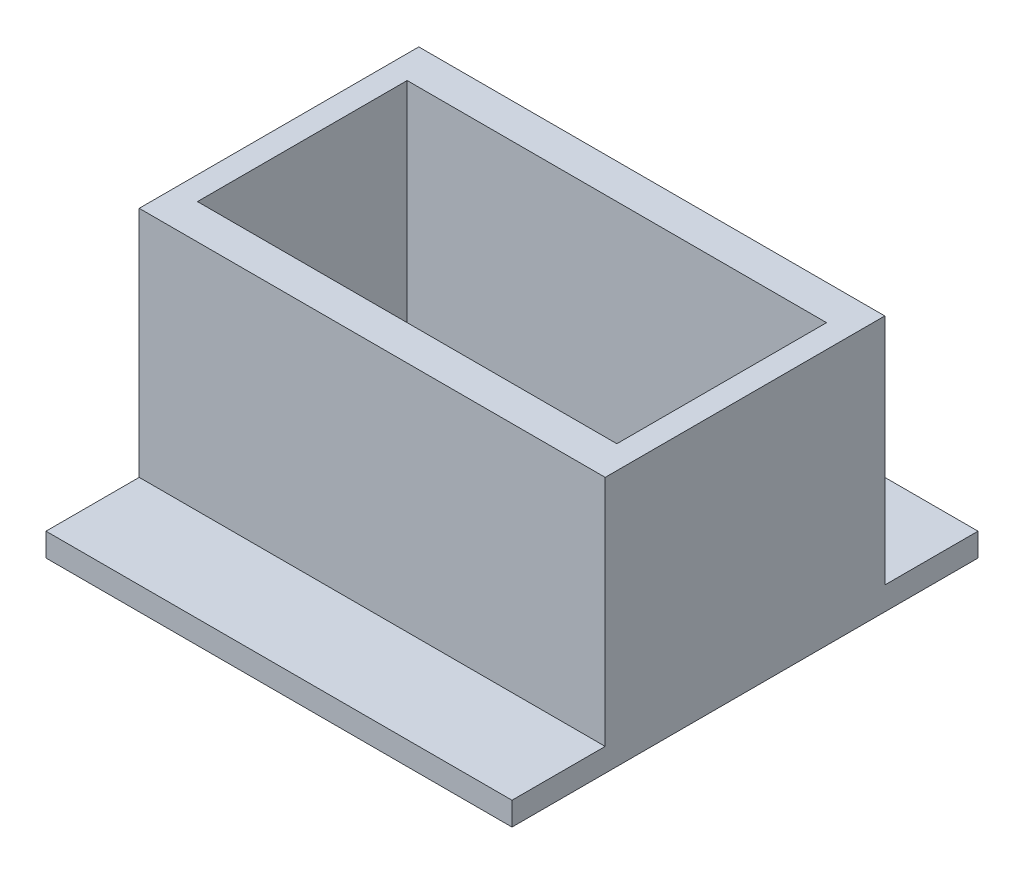
from build123d import *

# Parameters (mm, degrees)
SKETCH1_W           = 50.8
SKETCH1_H           = 50.8
BOSS_EXTRUDE1_DEPTH = 2.54
SKETCH2_W           = 50.8
SKETCH2_H           = 50.8
SKETCH2_W_2         = 45.72
SKETCH2_H_2         = 22.86
BOSS_EXTRUDE2_DEPTH = 25.4
SKETCH3_W           = 50.8
SKETCH3_H           = 10.16
CUT_EXTRUDE1_DEPTH  = 25.4


with BuildPart() as part:
    # Sketch1 → Boss-Extrude1 (new body)
    with BuildSketch(Plane(origin=(0, 0, 0), x_dir=(1, 0, 0), z_dir=(0, 1, 0))):
        with Locations((25.4, 25.4)):
            Rectangle(SKETCH1_W, SKETCH1_H)
    extrude(amount=BOSS_EXTRUDE1_DEPTH)

    # Sketch2 → Boss-Extrude2 (add)
    with BuildSketch(Plane(origin=(0, 2.54, 0), x_dir=(1, 0, 0), z_dir=(0, 1, 0))):
        with Locations((25.4, 25.4)):
            Rectangle(SKETCH2_W, SKETCH2_H)
        with Locations((25.4, 25.4)):
            Rectangle(SKETCH2_W_2, SKETCH2_H_2, mode=Mode.SUBTRACT)
    extrude(amount=BOSS_EXTRUDE2_DEPTH)

    # Sketch3 → Cut-Extrude1 (cut)
    with BuildSketch(Plane(origin=(0, 27.94, 0), x_dir=(1, 0, 0), z_dir=(0, 1, 0))):
        with Locations((25.4, 45.72)):
            Rectangle(SKETCH3_W, SKETCH3_H)
        with Locations((25.4, 5.08)):
            Rectangle(SKETCH3_W, SKETCH3_H)
    extrude(amount=-CUT_EXTRUDE1_DEPTH, mode=Mode.SUBTRACT)


solid = part.part
